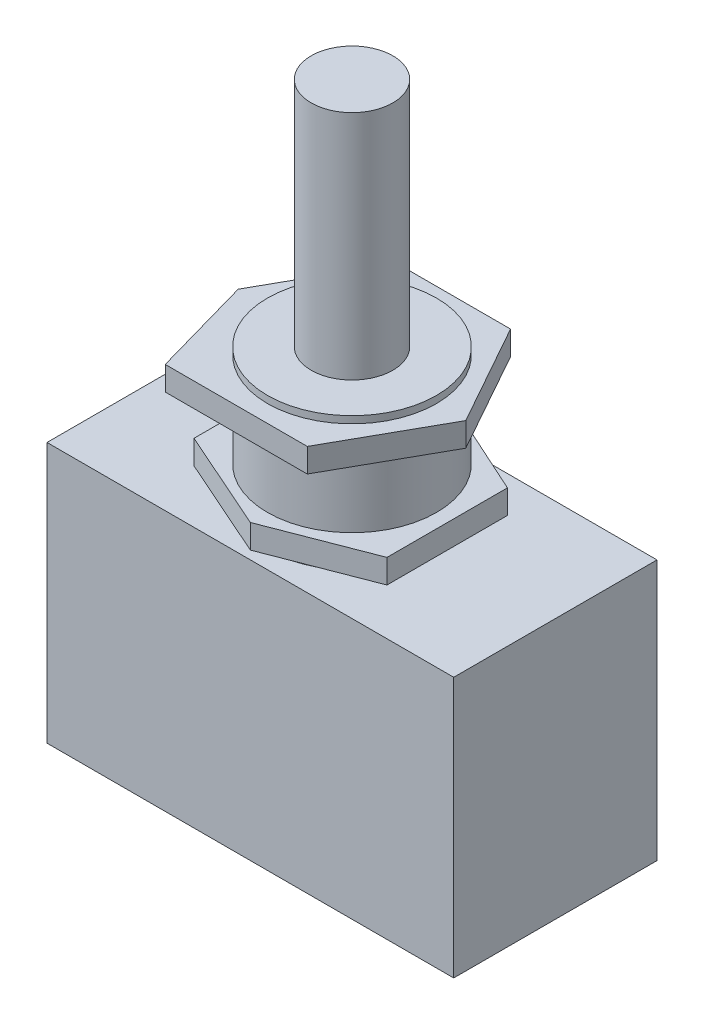
from build123d import *

# Parameters (mm, degrees)
BODYPROFILE_W         = 28.89
BODYPROFILE_H         = 18.5
BODYBOSS_DEPTH        = 7.22
BUSHINGSTEMPROFILE_R  = 6
BUSHINGSTEM_DEPTH     = 9.5
WASHERPROFILE_R       = 6
WASHERBOSS_DEPTH      = 0.6
LOWERNUTBOSS_DEPTH    = 1.7
UPPERNUTBOSS_START    = 5
UPPERNUTBOSS_DEPTH    = 1.7
ACTUATORBASEPROFILE_R = 2.9
ACTUATORBOSS_DEPTH    = 16.45
LEFTTERMINALPROFILE_W = 1.6
LEFTTERMINALPROFILE_H = 6.2
TERMINALBOSSES_DEPTH  = 10.5


with BuildPart() as part:
    # BodyProfile → BodyBoss (new, symmetric)
    with BuildSketch(Plane.XY):
        Rectangle(BODYPROFILE_W, BODYPROFILE_H)
    extrude(amount=BODYBOSS_DEPTH, both=True)

    # BushingStemProfile → BushingStem (add)
    with BuildSketch(Plane(origin=(0, 9.25, 0), x_dir=(1, 0, 0), z_dir=(0, 1, 0))):
        with Locations(Location((0, 0, 0), (0, 0, 270))):
            Circle(BUSHINGSTEMPROFILE_R)
    extrude(amount=BUSHINGSTEM_DEPTH)

    # WasherProfile → WasherBoss (add)
    with BuildSketch(Plane(origin=(0, 9.25, 0), x_dir=(1, 0, 0), z_dir=(0, 1, 0))):
        with Locations(Location((0, 0, 0), (0, 0, 270))):
            Circle(WASHERPROFILE_R)
    extrude(amount=WASHERBOSS_DEPTH)

    # LowerNutProfile → LowerNutBoss (add)
    with BuildSketch(Plane(origin=(0, 9.85, 0), x_dir=(1, 0, 0), z_dir=(0, 1, 0))):
        Polygon((7, 4.0415), (0, 7.22), (-7.181103891, 4.52386712), (-7.181103891, -4.0415), (0, -7.22), (7, -4.515434504), align=None)
    extrude(amount=LOWERNUTBOSS_DEPTH)

    # UpperNutProfile → UpperNutBoss (add)
    with BuildSketch(Plane(origin=(0, 11.55, 0), x_dir=(1, 0, 0), z_dir=(0, 1, 0)).offset(UPPERNUTBOSS_START)):
        Polygon((8.083, 0), (4.0415, 7.22), (-4.0415, 7.22), (-8.083, 0), (-6.045192426, -7.22), (4.0415, -7.22), align=None)
    extrude(amount=UPPERNUTBOSS_DEPTH)

    # ActuatorBaseProfile → ActuatorBoss (add)
    with BuildSketch(Plane(origin=(0, 18.75, 0), x_dir=(1, 0, 0), z_dir=(0, 1, 0))):
        with Locations(Location((0, 0, 0), (0, 0, 270))):
            Circle(ACTUATORBASEPROFILE_R)
    extrude(amount=ACTUATORBOSS_DEPTH)

    # LeftTerminalProfile → TerminalBosses (add)
    with BuildSketch(Plane(origin=(0, 0, 0), x_dir=(1, 0, 0), z_dir=(0, 1, 0))):
        with Locations((-8, 0)):
            Rectangle(LEFTTERMINALPROFILE_W, LEFTTERMINALPROFILE_H)
        with Locations((8, 0)):
            Rectangle(LEFTTERMINALPROFILE_W, LEFTTERMINALPROFILE_H)
    extrude(amount=-TERMINALBOSSES_DEPTH)


solid = part.part
